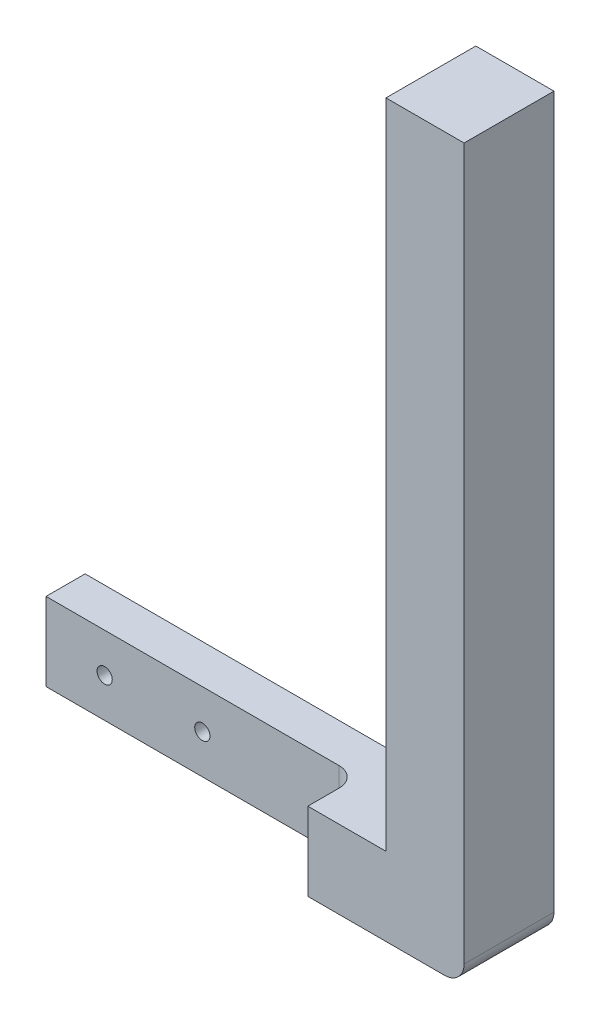
from build123d import *

# Parameters (mm, degrees)
SKETCH_1_W          = 100
SKETCH_1_H          = 20
SKETCH_1_R          = 1.95
EXTRUDE_1_DEPTH     = 10
SKETCH_2_W          = 20
SKETCH_2_H          = 20
EXTRUDE_2_DEPTH     = 13
SKETCH_4_W          = 20
SKETCH_4_H          = 23
EXTRUDE_3_DEPTH     = 187
FILLET_2_R          = 5
FILLET_3_R          = 5
SKETCH_5_R          = 1.925
CUT_EXTRUDE_1_DEPTH = 5


with BuildPart() as part:
    # 草圖1 → 填料-伸長1 (new body)
    with BuildSketch(Plane.XY):
        with Locations((50, 10)):
            Rectangle(SKETCH_1_W, SKETCH_1_H)
        with Locations((15, 10)):
            Circle(SKETCH_1_R, mode=Mode.SUBTRACT)
        with Locations((40, 10)):
            Circle(SKETCH_1_R, mode=Mode.SUBTRACT)
    extrude(amount=EXTRUDE_1_DEPTH)

    # 草圖2 → 填料-伸長2 (add)
    with BuildSketch(Plane.XY.offset(10)):
        with Locations((90, 10)):
            Rectangle(SKETCH_2_W, SKETCH_2_H)
    extrude(amount=EXTRUDE_2_DEPTH)

    # 草圖4 → 填料-伸長3 (add)
    with BuildSketch(Plane.XZ):
        with Locations((110, 11.5)):
            Rectangle(SKETCH_4_W, SKETCH_4_H)
    extrude(amount=-EXTRUDE_3_DEPTH)

    # 圓角2
    fillet_2_edges = [part.edges().sort_by_distance(p)[0] for p in [
        (80, 10, 10),
    ]]
    fillet(fillet_2_edges, radius=FILLET_2_R)

    # 圓角3
    fillet_3_edges = [part.edges().sort_by_distance(p)[0] for p in [
        (120, 0, 11.5),
    ]]
    fillet(fillet_3_edges, radius=FILLET_3_R)

    # 草圖5 → 除料-伸長1 (cut)
    with BuildSketch(Plane.XY):
        with Locations((110, 177)):
            Circle(SKETCH_5_R)
        with Locations((110, 162)):
            Circle(SKETCH_5_R)
    extrude(amount=CUT_EXTRUDE_1_DEPTH, mode=Mode.SUBTRACT)


solid = part.part
